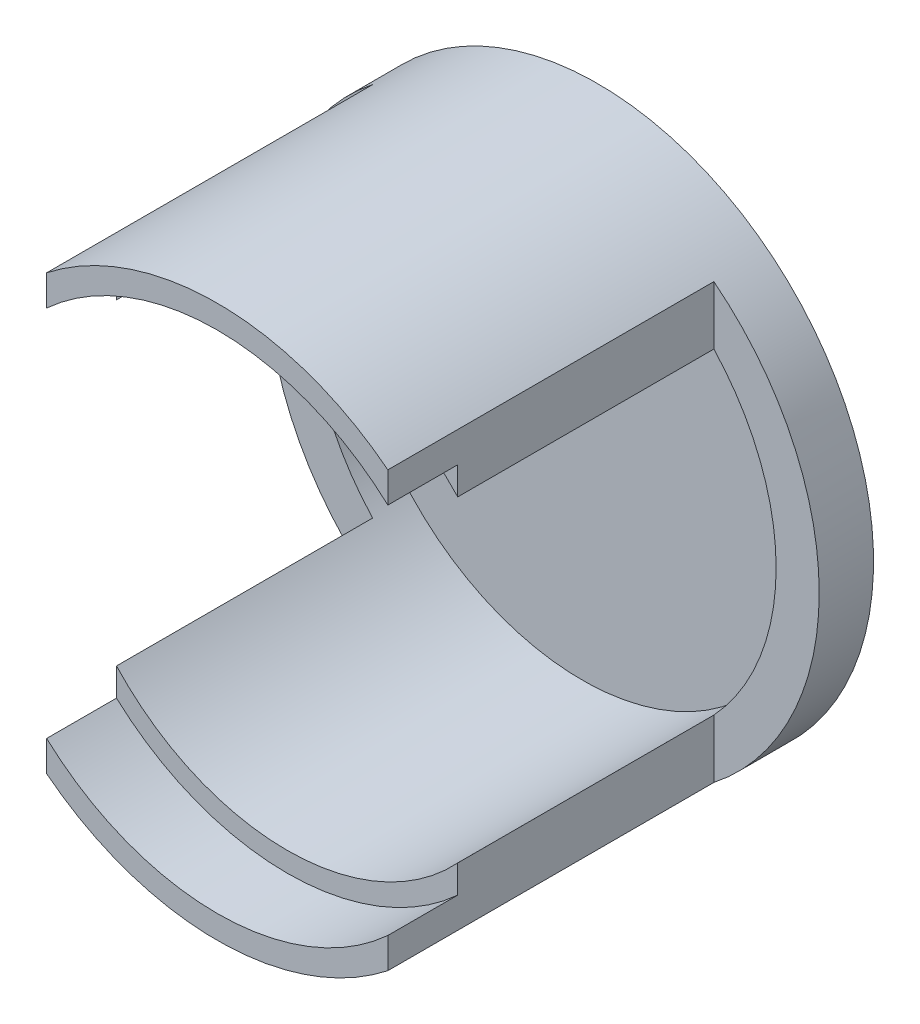
from build123d import *

# Parameters (mm, degrees)
SKETCH1_R           = 35.55
SKETCH1_R_2         = 32.55
BOSS_EXTRUDE1_DEPTH = 47
BOSS_EXTRUDE2_START = 2
SKETCH2_R           = 35.55
BOSS_EXTRUDE2_DEPTH = 2
SKETCH4_R           = 32.55
SKETCH4_R_2         = 30
BOSS_EXTRUDE3_DEPTH = 38
CUT_EXTRUDE1_START  = -42
CUT_EXTRUDE1_DEPTH  = 42


with BuildPart() as part:
    # Sketch1 → Boss-Extrude1 (new body)
    with BuildSketch(Plane.XY):
        Circle(SKETCH1_R)
        Circle(SKETCH1_R_2, mode=Mode.SUBTRACT)
    extrude(amount=BOSS_EXTRUDE1_DEPTH)

    # Sketch2 → Boss-Extrude2 (add)
    with BuildSketch(Plane(origin=(0, 0, 0), x_dir=(-1, 0, 0), z_dir=(0, 0, -1)).offset(BOSS_EXTRUDE2_START)):
        Circle(SKETCH2_R)
    extrude(amount=-BOSS_EXTRUDE2_DEPTH)

    # Sketch4 → Boss-Extrude3 (add)
    with BuildSketch(Plane.XY):
        Circle(SKETCH4_R)
        Circle(SKETCH4_R_2, mode=Mode.SUBTRACT)
    extrude(amount=BOSS_EXTRUDE3_DEPTH)

    # Sketch5 → Cut-Extrude1 (cut)
    with BuildSketch(Plane.XY.offset(47).offset(CUT_EXTRUDE1_START)):
        with BuildLine():
            Line((-35.55, 35.55), (-35.55, -3.6e-08))
            ThreePointArc((-35.55, -3.6e-08), (-31.978075564, 15.530781797), (-21.980088117, 27.940619649))
            Line((-21.980088117, 27.940619649), (-21.980088117, 35.55))
            Line((-21.980088117, 35.55), (-35.55, 35.55))
        make_face()
        with BuildLine():
            ThreePointArc((-21.980088117, 27.940619649), (-31.978075564, 15.530781797), (-35.55, -3.6e-08))
            ThreePointArc((-35.55, -3.6e-08), (-31.978075549, -15.530781829), (-21.980088117, -27.940619649))
            Line((-21.980088117, -27.940619649), (-21.980088117, -24.007878423))
            ThreePointArc((-21.980088117, -24.007878423), (-32.55, 0), (-21.980088117, 24.007878423))
            Line((-21.980088117, 24.007878423), (-21.980088117, 27.940619649))
        make_face()
        with BuildLine():
            ThreePointArc((-21.980088117, 24.007878423), (-32.55, 0), (-21.980088117, -24.007878423))
            Line((-21.980088117, -24.007878423), (-21.980088117, 24.007878423))
        make_face()
        with BuildLine():
            Line((-35.55, -3.6e-08), (-35.55, -35.55))
            Line((-35.55, -35.55), (-21.980088117, -35.55))
            Line((-21.980088117, -35.55), (-21.980088117, -27.940619649))
            ThreePointArc((-21.980088117, -27.940619649), (-31.978075549, -15.530781829), (-35.55, -3.6e-08))
        make_face()
        with BuildLine():
            Line((21.980088117, -27.940619649), (21.980088117, -35.55))
            Line((21.980088117, -35.55), (35.55, -35.55))
            Line((35.55, -35.55), (35.55, 0))
            ThreePointArc((35.55, 0), (31.978075556, -15.530781813), (21.980088117, -27.940619649))
        make_face()
        with BuildLine():
            Line((21.980088117, -24.007878423), (21.980088117, -27.940619649))
            ThreePointArc((21.980088117, -27.940619649), (31.978075556, -15.530781813), (35.55, 0))
            ThreePointArc((35.55, 0), (31.978075556, 15.530781813), (21.980088117, 27.940619649))
            Line((21.980088117, 27.940619649), (21.980088117, 24.007878423))
            ThreePointArc((21.980088117, 24.007878423), (29.790555284, 13.115842172), (32.55, 0))
            ThreePointArc((32.55, 0), (29.790555284, -13.115842172), (21.980088117, -24.007878423))
        make_face()
        with BuildLine():
            Line((21.980088117, 24.007878423), (21.980088117, -24.007878423))
            ThreePointArc((21.980088117, -24.007878423), (29.790555284, -13.115842172), (32.55, 0))
            ThreePointArc((32.55, 0), (29.790555284, 13.115842172), (21.980088117, 24.007878423))
        make_face()
        with BuildLine():
            ThreePointArc((21.980088117, 27.940619649), (31.978075556, 15.530781813), (35.55, 0))
            Line((35.55, 0), (35.55, 35.55))
            Line((35.55, 35.55), (21.980088117, 35.55))
            Line((21.980088117, 35.55), (21.980088117, 27.940619649))
        make_face()
    extrude(amount=CUT_EXTRUDE1_DEPTH, mode=Mode.SUBTRACT)


solid = part.part
